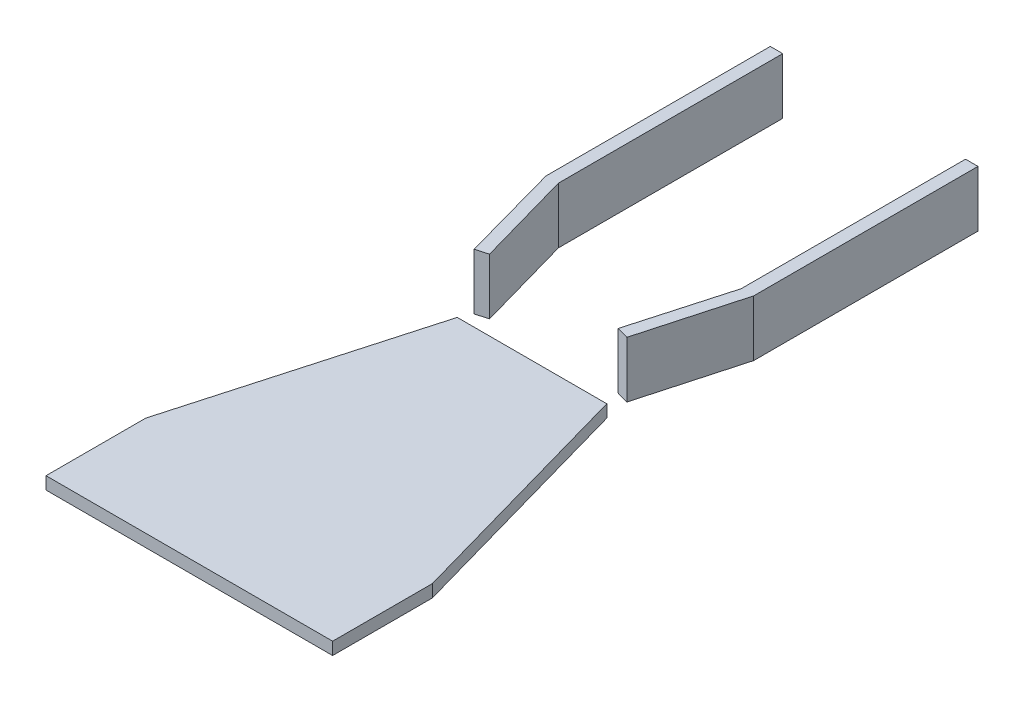
from build123d import *

# Parameters (mm, degrees)
SKETCH1_W           = 11.5
SKETCH1_H           = 8
BOSS_EXTRUDE1_DEPTH = 1
SKETCH3_W           = 1
SKETCH3_H           = 18
BOSS_EXTRUDE2_DEPTH = 4.5


with BuildPart() as part:
    # Sketch1 → Boss-Extrude1 (new body)
    with BuildSketch(Plane(origin=(0, 0, 0), x_dir=(1, 0, 0), z_dir=(0, 1, 0))):
        Polygon((-38.577353254, 12.685924323), (-44.077353254, -6.814075677), (-32.577353254, -6.814075677), (-32.577353254, 12.685924323), align=None)
        Polygon((-32.577353254, 12.685924323), (-32.577353254, -6.814075677), (-21.077353254, -6.814075677), (-26.577353254, 12.685924323), align=None)
        with Locations((-26.827353254, -10.814075677)):
            Rectangle(SKETCH1_W, SKETCH1_H)
        with Locations((-38.327353254, -10.814075677)):
            Rectangle(SKETCH1_W, SKETCH1_H)
    extrude(amount=BOSS_EXTRUDE1_DEPTH)


with BuildPart() as body_2:
    # Sketch3 → Boss-Extrude2 (new body)
    with BuildSketch(Plane(origin=(0, 0, 0), x_dir=(1, 0, 0), z_dir=(0, 1, 0))):
        with Locations((-40.84836488, 31.575836794)):
            Rectangle(SKETCH3_W, SKETCH3_H)
        Polygon((-39.139133236, 14.604779221), (-41.34836488, 22.575836794), (-40.34836488, 22.575836794), (-38.17668356, 14.876239386), align=None)
    extrude(amount=BOSS_EXTRUDE2_DEPTH)


with BuildPart() as body_3:
    # Mirror1: mirrored copy
    add(body_2.part.mirror(Plane(origin=(-40.34836488, 4.5, 0), x_dir=(0, 0, 1), z_dir=(1, 0, 0))))


with BuildPart() as body_3_1:
    # Body-Move/Copy1: moved
    add(body_3.part.moved(Location((14.667988389, 0, 0))))


solid = Compound([part.part, body_2.part, body_3_1.part])
